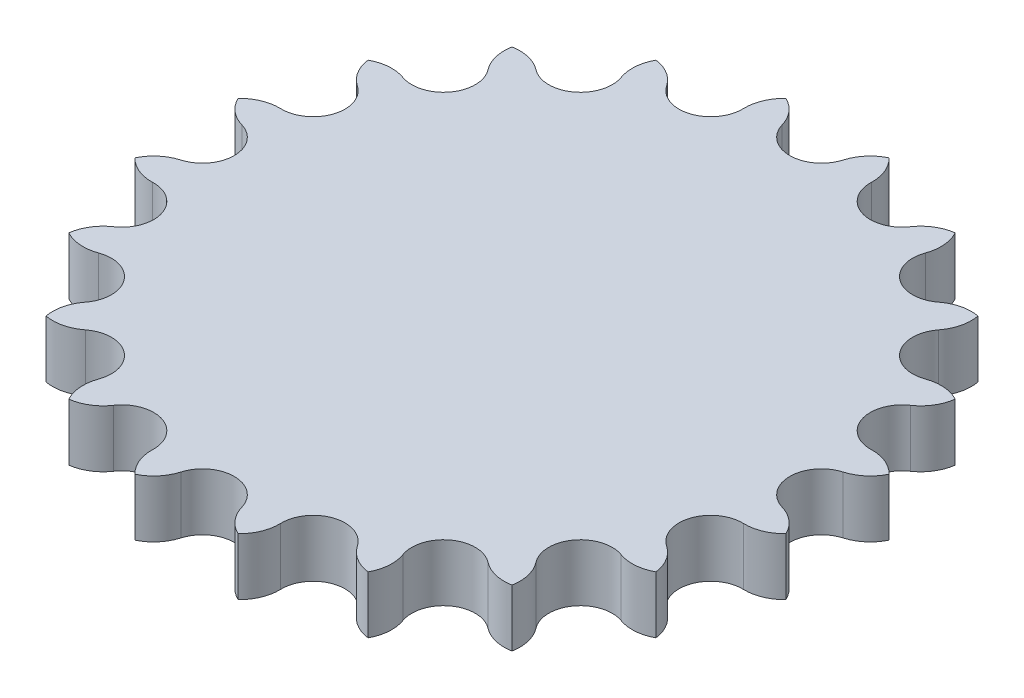
from build123d import *

# Parameters (mm, degrees)
SALIENTE_EXTRUIR2_DEPTH = 3.6


with BuildPart() as part:
    # Croquis1 → Saliente-Extruir2 (new, symmetric)
    with BuildSketch(Plane(origin=(0, 0, 0), x_dir=(1, 0, 0), z_dir=(0, 1, 0))):
        with BuildLine():
            ThreePointArc((-3.841343145, 37.884615385), (0, 35), (3.841343145, 37.884615385))
            ThreePointArc((3.841343145, 37.884615385), (4.833741548, 39.729116135), (6.494598229, 41.005279406))
            ThreePointArc((6.494598229, 41.005279406), (7.679810659, 39.278343072), (8.05365555, 37.217450642))
            ThreePointArc((8.05365555, 37.217450642), (10.815594803, 33.28697807), (15.360324409, 34.843370016))
            ThreePointArc((15.360324409, 34.843370016), (16.874133455, 36.290926502), (18.848058162, 36.991396957))
            ThreePointArc((18.848058162, 36.991396957), (19.441609492, 34.98273212), (19.160306326, 32.907182521))
            ThreePointArc((19.160306326, 32.907182521), (20.57248383, 28.315594803), (25.375730098, 28.391412822))
            ThreePointArc((25.375730098, 28.391412822), (27.26276761, 29.300328129), (29.35653884, 29.35653884))
            ThreePointArc((29.35653884, 29.35653884), (29.300328129, 27.26276761), (28.391412822, 25.375730098))
            ThreePointArc((28.391412822, 25.375730098), (28.315594803, 20.57248383), (32.907182521, 19.160306326))
            ThreePointArc((32.907182521, 19.160306326), (34.98273212, 19.441609492), (36.991396957, 18.848058162))
            ThreePointArc((36.991396957, 18.848058162), (36.290926502, 16.874133455), (34.843370016, 15.360324409))
            ThreePointArc((34.843370016, 15.360324409), (33.28697807, 10.815594803), (37.217450642, 8.05365555))
            ThreePointArc((37.217450642, 8.05365555), (39.278343072, 7.679810659), (41.005279406, 6.494598229))
            ThreePointArc((41.005279406, 6.494598229), (39.729116135, 4.833741548), (37.884615385, 3.841343145))
            ThreePointArc((37.884615385, 3.841343145), (35, 0), (37.884615385, -3.841343145))
            ThreePointArc((37.884615385, -3.841343145), (39.729116135, -4.833741548), (41.005279406, -6.494598229))
            ThreePointArc((41.005279406, -6.494598229), (39.278343072, -7.679810659), (37.217450642, -8.05365555))
            ThreePointArc((37.217450642, -8.05365555), (33.28697807, -10.815594803), (34.843370016, -15.360324409))
            ThreePointArc((34.843370016, -15.360324409), (36.290926502, -16.874133455), (36.991396957, -18.848058162))
            ThreePointArc((36.991396957, -18.848058162), (34.98273212, -19.441609492), (32.907182521, -19.160306326))
            ThreePointArc((32.907182521, -19.160306326), (28.315594803, -20.57248383), (28.391412822, -25.375730098))
            ThreePointArc((28.391412822, -25.375730098), (29.300328129, -27.26276761), (29.35653884, -29.35653884))
            ThreePointArc((29.35653884, -29.35653884), (27.26276761, -29.300328129), (25.375730098, -28.391412822))
            ThreePointArc((25.375730098, -28.391412822), (20.57248383, -28.315594803), (19.160306326, -32.907182521))
            ThreePointArc((19.160306326, -32.907182521), (19.441609492, -34.98273212), (18.848058162, -36.991396957))
            ThreePointArc((18.848058162, -36.991396957), (16.874133455, -36.290926502), (15.360324409, -34.843370016))
            ThreePointArc((15.360324409, -34.843370016), (10.815594803, -33.28697807), (8.05365555, -37.217450642))
            ThreePointArc((8.05365555, -37.217450642), (7.679810659, -39.278343072), (6.494598229, -41.005279406))
            ThreePointArc((6.494598229, -41.005279406), (4.833741548, -39.729116135), (3.841343145, -37.884615385))
            ThreePointArc((3.841343145, -37.884615385), (0, -35), (-3.841343145, -37.884615385))
            ThreePointArc((-3.841343145, -37.884615385), (-4.833741548, -39.729116135), (-6.494598229, -41.005279406))
            ThreePointArc((-6.494598229, -41.005279406), (-7.679810659, -39.278343072), (-8.05365555, -37.217450642))
            ThreePointArc((-8.05365555, -37.217450642), (-10.815594803, -33.28697807), (-15.360324409, -34.843370016))
            ThreePointArc((-15.360324409, -34.843370016), (-16.874133455, -36.290926502), (-18.848058162, -36.991396957))
            ThreePointArc((-18.848058162, -36.991396957), (-19.441609492, -34.98273212), (-19.160306326, -32.907182521))
            ThreePointArc((-19.160306326, -32.907182521), (-20.57248383, -28.315594803), (-25.375730098, -28.391412822))
            ThreePointArc((-25.375730098, -28.391412822), (-27.26276761, -29.300328129), (-29.35653884, -29.35653884))
            ThreePointArc((-29.35653884, -29.35653884), (-29.300328129, -27.26276761), (-28.391412822, -25.375730098))
            ThreePointArc((-28.391412822, -25.375730098), (-28.315594803, -20.57248383), (-32.907182521, -19.160306326))
            ThreePointArc((-32.907182521, -19.160306326), (-34.98273212, -19.441609492), (-36.991396957, -18.848058162))
            ThreePointArc((-36.991396957, -18.848058162), (-36.290926502, -16.874133455), (-34.843370016, -15.360324409))
            ThreePointArc((-34.843370016, -15.360324409), (-33.28697807, -10.815594803), (-37.217450642, -8.05365555))
            ThreePointArc((-37.217450642, -8.05365555), (-39.278343072, -7.679810659), (-41.005279406, -6.494598229))
            ThreePointArc((-41.005279406, -6.494598229), (-39.729116135, -4.833741548), (-37.884615385, -3.841343145))
            ThreePointArc((-37.884615385, -3.841343145), (-35, 0), (-37.884615385, 3.841343145))
            ThreePointArc((-37.884615385, 3.841343145), (-39.729116135, 4.833741548), (-41.005279406, 6.494598229))
            ThreePointArc((-41.005279406, 6.494598229), (-39.278343072, 7.679810659), (-37.217450642, 8.05365555))
            ThreePointArc((-37.217450642, 8.05365555), (-33.28697807, 10.815594803), (-34.843370016, 15.360324409))
            ThreePointArc((-34.843370016, 15.360324409), (-36.290926502, 16.874133455), (-36.991396957, 18.848058162))
            ThreePointArc((-36.991396957, 18.848058162), (-34.98273212, 19.441609492), (-32.907182521, 19.160306326))
            ThreePointArc((-32.907182521, 19.160306326), (-28.315594803, 20.57248383), (-28.391412822, 25.375730098))
            ThreePointArc((-28.391412822, 25.375730098), (-29.300328129, 27.26276761), (-29.35653884, 29.35653884))
            ThreePointArc((-29.35653884, 29.35653884), (-27.26276761, 29.300328129), (-25.375730098, 28.391412822))
            ThreePointArc((-25.375730098, 28.391412822), (-20.57248383, 28.315594803), (-19.160306326, 32.907182521))
            ThreePointArc((-19.160306326, 32.907182521), (-19.441609492, 34.98273212), (-18.848058162, 36.991396957))
            ThreePointArc((-18.848058162, 36.991396957), (-16.874133455, 36.290926502), (-15.360324409, 34.843370016))
            ThreePointArc((-15.360324409, 34.843370016), (-10.815594803, 33.28697807), (-8.05365555, 37.217450642))
            ThreePointArc((-8.05365555, 37.217450642), (-7.679810659, 39.278343072), (-6.494598229, 41.005279406))
            ThreePointArc((-6.494598229, 41.005279406), (-4.833741548, 39.729116135), (-3.841343145, 37.884615385))
        make_face()
    extrude(amount=SALIENTE_EXTRUIR2_DEPTH, both=True)


solid = part.part
